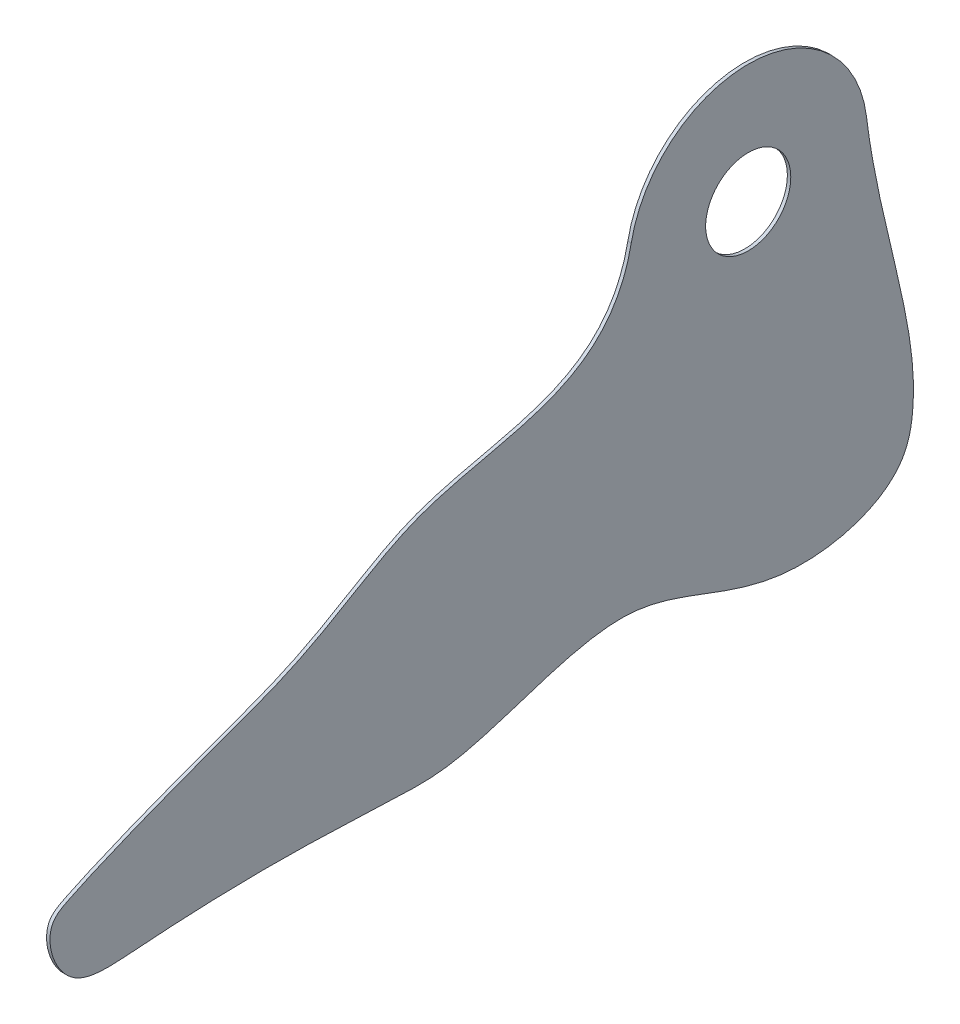
from build123d import *

# Parameters (mm, degrees)
SKETCH3_R      = 12.5
EXTRUDE1_DEPTH = 0.5


with BuildPart() as part:
    # Sketch3 → Extrude1 (new, symmetric)
    with BuildSketch(Plane(origin=(0, 0, 0), x_dir=(0, 0, -1), z_dir=(1, 0, 0))):
        with BuildLine():
            ThreePointArc((34.73691178, 104.283335151), (1.222243483, 134.978652359), (-34.353212623, 106.697520622))
            add(Edge.make_bspline(
                [(-34.353212623, 106.697520622), (-36.338972358, 96.512075849), (-50.948831396, 74.621034336), (-85.726167749, 74.271899833), (-114.840028166, 59.528628021), (-128.722122798, 49.71837198), (-165.298947788, 36.565409182), (-189.653696471, 27.320369224), (-207.902909488, 18.046659206), (-201.423126117, -2.048283715), (-146.593854224, 2.641541989), (-120.144568988, 0.641539371), (-77.992228934, -0.701008571), (-34.701952194, 23.728004024), (4.097875112, -6.357223424), (45.175428135, 4.464602831), (52.106608396, 40.381527834), (38.678563253, 72.343162646), (34.73691178, 104.283335151)],
                knots=[0, 0, 0, 0, 0.054541446, 0.16881351, 0.190561729, 0.262972312, 0.2823531, 0.364988827, 0.379148175, 0.409787233, 0.430597399, 0.566439677, 0.595187436, 0.701094703, 0.796074322, 0.860423876, 0.880816444, 1, 1, 1, 1], degree=3))
        make_face()
        with Locations((0, 100)):
            Circle(SKETCH3_R, mode=Mode.SUBTRACT)
    extrude(amount=EXTRUDE1_DEPTH, both=True)


solid = part.part
